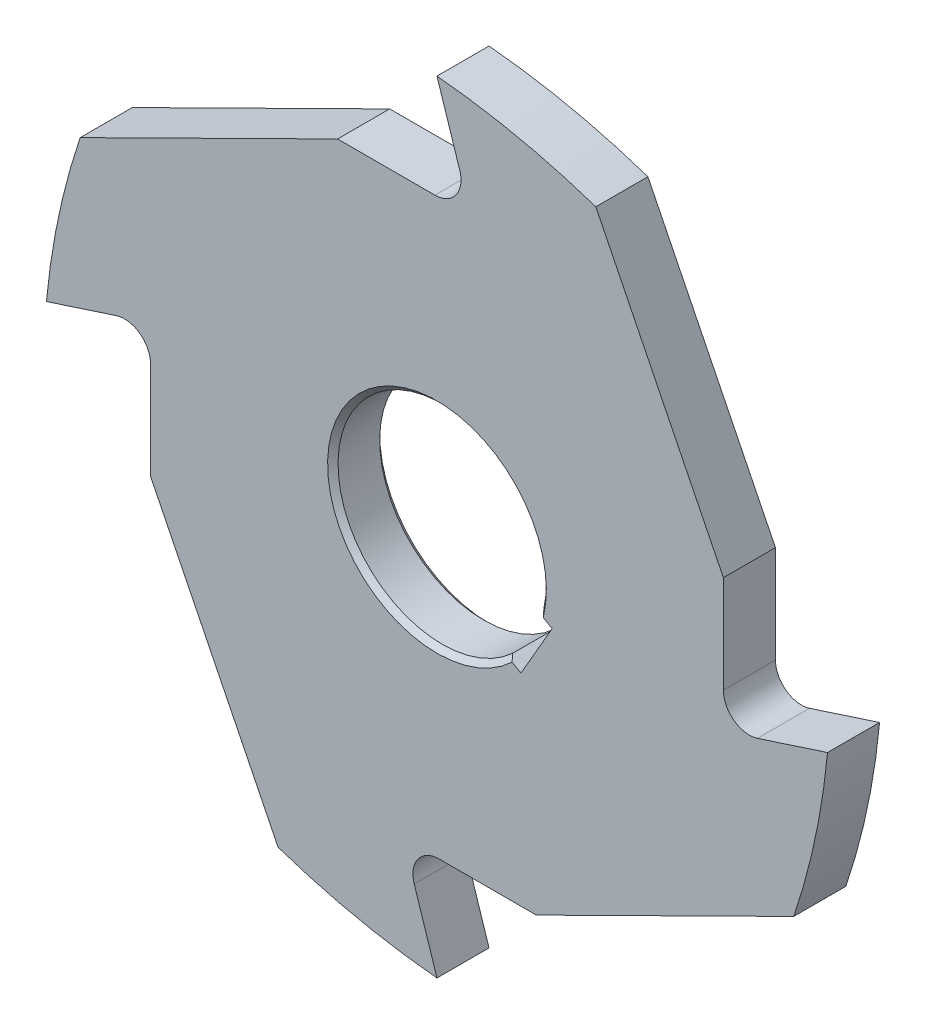
from build123d import *

# Parameters (mm, degrees)
BOSS_EXTRUDE1_DEPTH = 10
CHAMFER1_SIZE       = 1


with BuildPart() as part:
    # Sketch1 → Boss-Extrude1 (new body)
    with BuildSketch(Plane.XY):
        with BuildLine():
            ThreePointArc((4.371766903777949, 61.5450849718747), (3.661569294176898, 57.06107373853762), (-0.38351567769782763, 55))
            Line((-0.38351567769782763, 55), (-19.078784028338333, 54.99999999999999))
            Line((-19.078784028338333, 55.0000000000002), (-68.51590932319446, 30.505248230686387))
            ThreePointArc((-68.51590932319446, 30.50524823068639), (-72.64180115025157, 15.440491486016093), (-75.00000000000001, 7.8515e-13))
            Line((-75.00000000000001, 7.8558e-13), (-61.545084971874644, 4.371766903778592))
            ThreePointArc((-61.545084971874644, 4.37176690377859), (-57.06107373853757, 3.6615692941774913), (-55, -0.38351567769725153))
            Line((-55.00000000000001, -0.38351567769725153), (-55.000000000000135, -19.078784028338532))
            Line((-55.000000000000135, -19.078784028338532), (-30.50524823068615, -68.51590932319456))
            ThreePointArc((-30.505248230686153, -68.51590932319459), (-15.440491486015834, -72.64180115025164), (-5.2403e-13, -75.00000000000003))
            Line((-5.2372e-13, -75.00000000000001), (-4.371766903778377, -61.54508497187467))
            ThreePointArc((-4.371766903778381, -61.54508497187467), (-3.661569294177295, -57.061073738537594), (0.38351567769744355, -55))
            Line((0.38351567769744355, -55.00000000000001), (19.078784028338724, -55.00000000000007))
            Line((19.078784028338724, -55.00000000000007), (68.51590932319466, -30.50524823068591))
            ThreePointArc((68.51590932319468, -30.505248230685908), (72.64180115025168, -15.440491486015581), (75.00000000000001, -2.6112e-13))
            Line((75.00000000000001, -2.6186e-13), (61.54508497187469, -4.371766903778163))
            ThreePointArc((61.54508497187469, -4.371766903778164), (57.06107373853761, -3.6615692941770925), (55, 0.3835156776976356))
            Line((55.00000000000001, 0.3835156776976356), (55, 19.078784028338916))
            Line((55, 19.078784028338916), (30.50524823068567, 68.51590932319478))
            ThreePointArc((30.50524823068567, 68.51590932319476), (15.440491486015329, 72.64180115025172), (0, 75))
            Line((0, 75.00000000000001), (4.371766903777948, 61.5450849718747))
        make_face()
        with BuildLine():
            Line((16.12078785321155, -16.235544436876165), (13.522711641858239, -14.735544436876154))
            ThreePointArc((13.52271164185824, -14.735544436876154), (-6.000000000000136, -19.078784028338873), (-19.522711641858354, -4.343239591462642))
            ThreePointArc((-19.52271164185835, -4.343239591462641), (-13.522711641858244, 14.735544436876156), (6.000000000000001, 19.078784028338916))
            ThreePointArc((5.999999999999998, 19.078784028338916), (17.320508075688796, 9.999999999999961), (19.522711641858287, -4.3432395914629165))
            Line((19.522711641858287, -4.343239591462916), (22.1207878532116, -5.843239591462927))
            Line((22.1207878532116, -5.843239591462927), (16.12078785321155, -16.235544436876165))
        make_face(mode=Mode.SUBTRACT)
    extrude(amount=-BOSS_EXTRUDE1_DEPTH)

    # Chamfer1
    chamfer1_edges = [part.edges().sort_by_distance(p)[0] for p in [
        (-19.522711641858322, -4.343239591462766, 0),
        (-19.522711641858322, -4.343239591462773, -10),
    ]]
    chamfer(chamfer1_edges, length=CHAMFER1_SIZE)


solid = part.part
